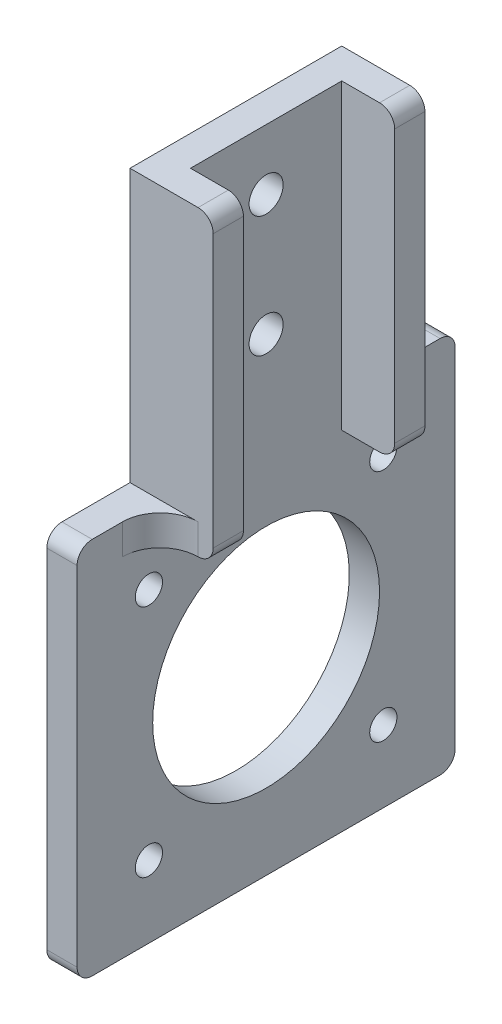
from build123d import *

# Parameters (mm, degrees)
SKETCH1_W           = 28
SKETCH1_H           = 28
SKETCH1_W_2         = 20
SKETCH1_H_2         = 20
BOSS_EXTRUDE1_DEPTH = 40
SKETCH2_R           = 2.25
CUT_EXTRUDE1_DEPTH  = 30
SKETCH5_W           = 50
SKETCH5_H           = 50
SKETCH5_R           = 1.8
SKETCH5_R_2         = 15
BOSS_EXTRUDE2_DEPTH = 4
SKETCH6_W           = 17
SKETCH6_H           = 28
CUT_EXTRUDE2_DEPTH  = 40
FILLET1_R           = 2
FILLET2_R           = 5


with BuildPart() as part:
    # Sketch1 → Boss-Extrude1 (new body)
    with BuildSketch(Plane(origin=(0, 0, 0), x_dir=(1, 0, 0), z_dir=(0, 1, 0))):
        Rectangle(SKETCH1_W, SKETCH1_H)
        Rectangle(SKETCH1_W_2, SKETCH1_H_2, mode=Mode.SUBTRACT)
    extrude(amount=BOSS_EXTRUDE1_DEPTH)

    # Sketch2 → Cut-Extrude1 (cut)
    with BuildSketch(Plane.ZY.offset(14)):
        with Locations((0, 32)):
            Circle(SKETCH2_R)
        with Locations((0, 16)):
            Circle(SKETCH2_R)
    extrude(amount=-CUT_EXTRUDE1_DEPTH, mode=Mode.SUBTRACT)

    # Sketch5 → Boss-Extrude2 (add)
    with BuildSketch(Plane.ZY.offset(14)):
        with Locations((0, -21)):
            Rectangle(SKETCH5_W, SKETCH5_H)
        with Locations((-15.499780644, -5.500219356)):
            Circle(SKETCH5_R, mode=Mode.SUBTRACT)
        with Locations((15.499780644, -5.500219356)):
            Circle(SKETCH5_R, mode=Mode.SUBTRACT)
        with Locations((15.499780644, -36.499780644)):
            Circle(SKETCH5_R, mode=Mode.SUBTRACT)
        with Locations((-15.499780644, -36.499780644)):
            Circle(SKETCH5_R, mode=Mode.SUBTRACT)
        with Locations((0, -21)):
            Circle(SKETCH5_R_2, mode=Mode.SUBTRACT)
    extrude(amount=-BOSS_EXTRUDE2_DEPTH)

    # Sketch6 → Cut-Extrude2 (cut)
    with BuildSketch(Plane.XZ):
        with Locations((5.5, 0)):
            Rectangle(SKETCH6_W, SKETCH6_H)
    extrude(amount=-CUT_EXTRUDE2_DEPTH, mode=Mode.SUBTRACT)

    # Fillet1
    fillet1_edges = [part.edges().sort_by_distance(p)[0] for p in [
        (-3, 0, -12),
        (-3, 0, 12),
        (-12, 4, 25),
        (-12, -46, 25),
        (-12, -46, -25),
        (-12, 4, -25),
        (-3, 40, -12),
        (-3, 40, 12),
    ]]
    fillet(fillet1_edges, radius=FILLET1_R)

    # Fillet2
    fillet2_edges = [part.edges().sort_by_distance(p)[0] for p in [
        (-10, 2, -14),
        (-10, 2, 14),
    ]]
    fillet(fillet2_edges, radius=FILLET2_R)


solid = part.part
